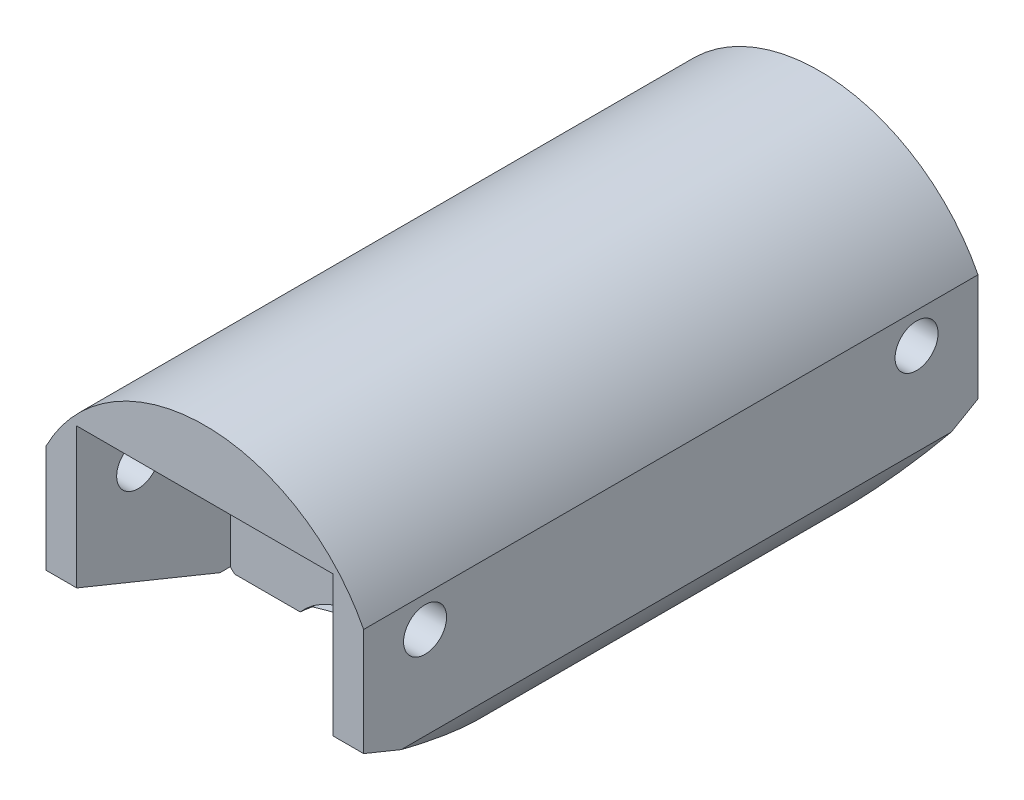
from build123d import *

# Parameters (mm, degrees)
BOSS_EXTRUDE1_DEPTH = 12.7
CUT_EXTRUDE1_DEPTH  = 21.412045122
CUT_EXTRUDE2_DEPTH  = 31.008691842
BOSS_EXTRUDE2_DEPTH = 13.1318
SKETCH7_W           = 2.54
SKETCH7_H           = 2.8575
CUT_EXTRUDE3_DEPTH  = 2.54
SKETCH9_W           = 2.54
SKETCH9_H           = 3.81
CUT_EXTRUDE5_DEPTH  = 20.522176282
SKETCH11_W          = 2.54
SKETCH11_H          = 3.81
CUT_EXTRUDE8_DEPTH  = 2.54
CUT_EXTRUDE9_DEPTH  = 1.27
CUT_EXTRUDE10_START = -2.54
SKETCH13_W          = 10.5918
SKETCH13_H          = 10.46363817
CUT_EXTRUDE10_DEPTH = 12.54
SKETCH10_R          = 0.889
CUT_EXTRUDE7_DEPTH  = 21.412045122
CUT_EXTRUDE11_DEPTH = 17.78
CUT_EXTRUDE12_DEPTH = 15.875
SKETCH16_W          = 0.284935898
SKETCH16_H          = 2.320192307
CUT_EXTRUDE13_DEPTH = 1


with BuildPart() as part:
    # Sketch1 → Boss-Extrude1 (new, symmetric)
    with BuildSketch(Plane.XY):
        with BuildLine():
            Line((0, 0), (0, 5.08))
            ThreePointArc((0, 5.08), (6.5659, 9.1059), (13.1318, 5.08))
            Line((13.1318, 5.08), (13.1318, 0))
            ThreePointArc((13.1318, 0), (6.5659, -4.0259), (0, 0))
        make_face()
    extrude(amount=BOSS_EXTRUDE1_DEPTH, both=True)

    # Sketch2 → Cut-Extrude1 (cut, through all)
    with BuildSketch(Plane(origin=(0, 0, 0), x_dir=(0, 0, -1), z_dir=(1, 0, 0))):
        Polygon((-12.7, -4.0259), (-12.7, 0.635), (-1.27, -4.0259), align=None)
        Polygon((12.7, 0.635), (12.7, -4.0259), (4.627084391, -4.0259), align=None)
        with BuildLine():
            Line((-10.16, 1.27), (-12.7, 1.27))
            Line((-12.7, 1.27), (-12.7, 3.81))
            Line((-12.7, 3.81), (-10.16, 3.81))
            ThreePointArc((-10.16, 3.81), (-5.420295474, 2.54), (-10.16, 1.27))
        make_face()
        with BuildLine():
            Line((10.16, 1.27), (12.7, 1.27))
            Line((12.7, 1.27), (12.7, 3.81))
            Line((12.7, 3.81), (10.16, 3.81))
            ThreePointArc((10.16, 3.81), (5.420295474, 2.54), (10.16, 1.27))
        make_face()
    extrude(amount=CUT_EXTRUDE1_DEPTH, mode=Mode.SUBTRACT)

    # Sketch3 → Cut-Extrude2 (cut, through all)
    with BuildSketch(Plane.XY.offset(12.7)):
        with BuildLine():
            ThreePointArc((3.929920413, -2.256087406), (6.5659, -2.7559), (9.201879587, -2.256087406))
            ThreePointArc((9.201879587, -2.256087406), (6.5659, -0.8509), (3.929920413, -2.256087406))
        make_face()
    extrude(amount=-CUT_EXTRUDE2_DEPTH, mode=Mode.SUBTRACT)

    # Sketch4 → Boss-Extrude2 (add)
    with BuildSketch(Plane.ZY):
        with BuildLine():
            Line((12.7, 1.27), (10.16, 1.27))
            ThreePointArc((10.16, 1.27), (9.230295474, 0.340295474), (7.960295474, 0))
            ThreePointArc((7.960295474, 0), (5.420295474, 2.54), (7.960295474, 5.08))
            ThreePointArc((7.960295474, 5.08), (9.230295474, 4.739704526), (10.16, 3.81))
            Line((10.16, 3.81), (12.7, 3.81))
            Line((12.7, 3.81), (12.7, 1.27))
        make_face()
        with BuildLine():
            Line((-10.16, 1.27), (-12.7, 1.27))
            Line((-12.7, 1.27), (-12.7, 3.81))
            Line((-12.7, 3.81), (-10.16, 3.81))
            ThreePointArc((-10.16, 3.81), (-9.230295474, 4.739704526), (-7.960295474, 5.08))
            ThreePointArc((-7.960295474, 5.08), (-5.420295474, 2.54), (-7.960295474, 0))
            ThreePointArc((-7.960295474, 0), (-9.230295474, 0.340295474), (-10.16, 1.27))
        make_face()
    extrude(amount=-BOSS_EXTRUDE2_DEPTH)

    # Sketch7 → Cut-Extrude3 (cut)
    with BuildSketch(Plane.ZY.offset(-5.08)):
        with Locations((-11.43, 1.42875)):
            Rectangle(SKETCH7_W, SKETCH7_H)
    extrude(amount=CUT_EXTRUDE3_DEPTH, mode=Mode.SUBTRACT)

    # Sketch9 → Cut-Extrude5 (cut, through all)
    with BuildSketch(Plane.XZ.offset(-2.8575)):
        with Locations((3.81, -10.795)):
            Rectangle(SKETCH9_W, SKETCH9_H)
    extrude(amount=CUT_EXTRUDE5_DEPTH, mode=Mode.SUBTRACT)

    # Sketch11 → Cut-Extrude8 (cut)
    with BuildSketch(Plane.XZ.offset(-2.8575)):
        with Locations((3.81, -10.795)):
            Rectangle(SKETCH11_W, SKETCH11_H)
    extrude(amount=-CUT_EXTRUDE8_DEPTH, mode=Mode.SUBTRACT)

    # Sketch12 → Cut-Extrude9 (cut)
    with BuildSketch(Plane(origin=(2.54, 0, 0), x_dir=(0, 0, -1), z_dir=(1, 0, 0))):
        Polygon((8.89, -1.564704526), (12.7, 0.635), (12.7, 5.3975), (8.89, 5.3975), align=None)
    extrude(amount=-CUT_EXTRUDE9_DEPTH, mode=Mode.SUBTRACT)

    # Sketch13 → Cut-Extrude10 (cut)
    with BuildSketch(Plane(origin=(0, 0, -8.89), x_dir=(-1, 0, 0), z_dir=(0, 0, -1)).offset(CUT_EXTRUDE10_START)):
        with Locations((-6.5659, 1.205919085)):
            Rectangle(SKETCH13_W, SKETCH13_H)
    cut_extrude10 = extrude(amount=CUT_EXTRUDE10_DEPTH, mode=Mode.SUBTRACT)

    # Sketch10 → Cut-Extrude7 (cut, through all)
    with BuildSketch(Plane.ZY):
        with Locations((-10.16, 3.81)):
            Circle(SKETCH10_R)
    cut_extrude7 = extrude(amount=-CUT_EXTRUDE7_DEPTH, mode=Mode.SUBTRACT)

    # Mirror1: Cut-Extrude10, Cut-Extrude7 across plane
    add(cut_extrude10.mirror(Plane(origin=(0, 0, 0), x_dir=(1, 0, 0), z_dir=(0, 0, -1))), mode=Mode.SUBTRACT)
    add(cut_extrude7.mirror(Plane(origin=(0, 0, 0), x_dir=(1, 0, 0), z_dir=(0, 0, -1))), mode=Mode.SUBTRACT)

    # Sketch14 → Cut-Extrude11 (cut)
    with BuildSketch(Plane.XY.offset(6.35)):
        with BuildLine():
            Line((8.5979, 5.338512594), (9.2329, 5.338512594))
            ThreePointArc((9.2329, 5.338512594), (9.6139, 4.957512594), (9.2329, 4.576512594))
            Line((9.2329, 4.576512594), (8.5979, 4.576512594))
            ThreePointArc((8.5979, 4.576512594), (8.2169, 4.957512594), (8.5979, 5.338512594))
        make_face()
    extrude(amount=-CUT_EXTRUDE11_DEPTH, mode=Mode.SUBTRACT)

    # Sketch15 → Cut-Extrude12 (cut)
    with BuildSketch(Plane(origin=(0, 0, -6.35), x_dir=(-1, 0, 0), z_dir=(0, 0, -1))):
        with BuildLine():
            Line((-4.9149, 5.477825791), (-4.2799, 5.477825791))
            ThreePointArc((-4.2799, 5.477825791), (-3.8989, 5.096825791), (-4.2799, 4.715825791))
            Line((-4.2799, 4.715825791), (-4.9149, 4.715825791))
            ThreePointArc((-4.9149, 4.715825791), (-5.2959, 5.096825791), (-4.9149, 5.477825791))
        make_face()
    extrude(amount=-CUT_EXTRUDE12_DEPTH, mode=Mode.SUBTRACT)

    # Sketch16 → Cut-Extrude13 (cut)
    # profile 1 of 7: a face of its own
    with BuildSketch(Plane.ZY):
        with BuildLine():
            Line((-6.896273002, 4.379184179), (-6.273611744, 4.379184179))
            add(Edge.make_bspline(
                [(-6.273611744, 4.379184179), (-6.230784708, 4.379137101), (-6.148726205, 4.379046899), (-6.031056118, 4.376312094), (-5.924185862, 4.372659309), (-5.828345873, 4.367595734), (-5.74324127, 4.361611685), (-5.669257148, 4.353218763), (-5.605811979, 4.344455495), (-5.567796843, 4.335546076), (-5.550459701, 4.331482857)],
                knots=[0, 0, 0, 0, 1.415646017, 2.712440637, 3.8905458, 4.950247383, 5.884950622, 6.709939814, 7.411656543, 8, 8, 8, 8], degree=3))
            add(Edge.make_bspline(
                [(-5.550459701, 4.331482857), (-5.52851271, 4.325475802), (-5.48513588, 4.313603242), (-5.422632791, 4.28982365), (-5.363166089, 4.261627686), (-5.306531746, 4.229493112), (-5.253425714, 4.192041207), (-5.203055662, 4.150790139), (-5.155866109, 4.104787502), (-5.112122418, 4.05454926), (-5.07194978, 4.000918784), (-5.03736071, 3.943095475), (-5.008398155, 3.88205265), (-4.983557615, 3.817832767), (-4.965679232, 3.749896545), (-4.952210973, 3.678716028), (-4.943662396, 3.604298844), (-4.942843644, 3.553444536), (-4.942426849, 3.527556574)],
                knots=[0, 0, 0, 0, 0.999701418, 1.975846123, 2.934577507, 3.890451536, 4.834027766, 5.787354733, 6.749476667, 7.726910423, 8.712836071, 9.690891519, 10.682875813, 11.679750201, 12.712814741, 13.765529915, 14.8625177, 16, 16, 16, 16], degree=3))
            add(Edge.make_bspline(
                [(-4.942426849, 3.527556574), (-4.942809141, 3.50145102), (-4.943557122, 3.450373739), (-4.952534466, 3.375649853), (-4.964626855, 3.304241027), (-4.983220609, 3.236305597), (-5.00757347, 3.172247005), (-5.036141261, 3.111086316), (-5.070597749, 3.053864043), (-5.110189844, 3.000372443), (-5.154233076, 2.950561308), (-5.202541099, 2.904791602), (-5.254918886, 2.863331238), (-5.311199977, 2.826087269), (-5.371933054, 2.793923358), (-5.436197008, 2.765114946), (-5.504550418, 2.740920484), (-5.551851128, 2.728193214), (-5.575900406, 2.72172224)],
                knots=[0, 0, 0, 0, 1.121902311, 2.195077645, 3.232258892, 4.234102512, 5.217864754, 6.176164875, 7.132989551, 8.084763148, 9.034132444, 9.988522005, 10.94243251, 11.903244335, 12.886203696, 13.894208494, 14.929344452, 16, 16, 16, 16], degree=3))
            add(Edge.make_bspline(
                [(-5.575900406, 2.72172224), (-5.595791631, 2.71749225), (-5.639384405, 2.708221981), (-5.711178161, 2.69787288), (-5.794767189, 2.689039486), (-5.8900374, 2.682416311), (-5.996903278, 2.676746334), (-6.115422633, 2.672239563), (-6.245828117, 2.669763195), (-6.33678846, 2.669635476), (-6.384278812, 2.669568794)],
                knots=[0, 0, 0, 0, 0.601384939, 1.31797006, 2.144135048, 3.087295005, 4.142315834, 5.309527816, 6.595305764, 8, 8, 8, 8], degree=3))
            Line((-6.384278812, 2.669568794), (-6.611337105, 2.669568794))
            Line((-6.611337105, 2.669568794), (-6.611337105, 1.204184179))
            Line((-6.611337105, 1.204184179), (-6.896273002, 1.204184179))
            Line((-6.896273002, 1.204184179), (-6.896273002, 4.379184179))
        make_face()
        with BuildLine():
            Line((-6.611337105, 4.053543153), (-6.611337105, 2.99520982))
            Line((-6.611337105, 2.99520982), (-6.055457698, 2.988213626))
            add(Edge.make_bspline(
                [(-6.055457698, 2.988213626), (-6.028316051, 2.988199598), (-5.975919661, 2.988172518), (-5.900231087, 2.991787685), (-5.830009805, 2.995961025), (-5.765471512, 3.00207147), (-5.706587114, 3.010708611), (-5.653258427, 3.01942783), (-5.605898963, 3.032041981), (-5.550473259, 3.049026479), (-5.488711936, 3.077993923), (-5.421522089, 3.120039895), (-5.3645802, 3.173634537), (-5.315305745, 3.23389407), (-5.276202556, 3.300931137), (-5.247576763, 3.372657959), (-5.230757284, 3.448338936), (-5.228501951, 3.500126034), (-5.227362746, 3.526284539)],
                knots=[0, 0, 0, 0, 1.160613943, 2.240541288, 3.23993089, 4.169200891, 5.011653406, 5.7853311, 6.478053781, 7.106038997, 8.262395093, 9.384106736, 10.481365981, 11.59014053, 12.70357646, 13.786202915, 14.881775077, 16, 16, 16, 16], degree=3))
            add(Edge.make_bspline(
                [(-5.227362746, 3.526284539), (-5.228508147, 3.551810191), (-5.230785062, 3.602552027), (-5.247708595, 3.676918474), (-5.276146901, 3.747889434), (-5.31556824, 3.814086447), (-5.363411979, 3.874129148), (-5.419019241, 3.926287256), (-5.482259128, 3.968216944), (-5.541085737, 3.995279992), (-5.593338242, 4.011803849), (-5.638724377, 4.02336524), (-5.689969489, 4.032595969), (-5.74709026, 4.040070375), (-5.809643959, 4.046468872), (-5.878168002, 4.050810437), (-5.952402807, 4.053351758), (-6.003938111, 4.05347781), (-6.03065301, 4.053543153)],
                knots=[0, 0, 0, 0, 1.120700087, 2.227813068, 3.331159281, 4.466773991, 5.599788987, 6.693661531, 7.80175334, 8.91857717, 9.525282508, 10.207424825, 10.974604443, 11.810962634, 12.737642355, 13.736264703, 14.826523623, 16, 16, 16, 16], degree=3))
            Line((-6.03065301, 4.053543153), (-6.611337105, 4.053543153))
        make_face(mode=Mode.SUBTRACT)
    # profile 2 of 7: a face of its own
    with BuildSketch(Plane.ZY):
        with BuildLine():
            add(Edge.make_bspline(
                [(-4.272064268, 4.501299563), (-4.25438286, 4.500479368), (-4.219759268, 4.498873268), (-4.169691089, 4.485119642), (-4.1241008, 4.461806356), (-4.083662428, 4.43052836), (-4.048962502, 4.393744222), (-4.024668572, 4.350871772), (-4.00905447, 4.304554293), (-4.007168923, 4.272246319), (-4.0062089, 4.255796759)],
                knots=[0, 0, 0, 0, 1.055194115, 2.066272739, 3.074728998, 4.095836921, 5.109056067, 6.073838105, 7.019297344, 8, 8, 8, 8], degree=3))
            add(Edge.make_bspline(
                [(-4.0062089, 4.255796759), (-4.007190573, 4.239774209), (-4.009131226, 4.208099525), (-4.024656512, 4.162585018), (-4.049169542, 4.120308275), (-4.083640177, 4.083595559), (-4.124106696, 4.052334854), (-4.169689523, 4.029016984), (-4.21975968, 4.015264573), (-4.254383, 4.013658306), (-4.272064268, 4.012838025)],
                knots=[0, 0, 0, 0, 0.96129708, 1.900370562, 2.859976407, 3.87933698, 4.906634145, 5.921202961, 6.938410037, 8, 8, 8, 8], degree=3))
            add(Edge.make_bspline(
                [(-4.272064268, 4.012838025), (-4.289543347, 4.013626985), (-4.323564089, 4.015162594), (-4.372882581, 4.029286824), (-4.41808414, 4.052342833), (-4.458601378, 4.083390873), (-4.492374482, 4.120533744), (-4.516956534, 4.162559217), (-4.532445964, 4.208106093), (-4.534391449, 4.239776416), (-4.535375566, 4.255796759)],
                knots=[0, 0, 0, 0, 1.054934014, 2.053291228, 3.073705704, 4.106921865, 5.123545215, 6.088680038, 7.033164197, 8, 8, 8, 8], degree=3))
            add(Edge.make_bspline(
                [(-4.535375566, 4.255796759), (-4.534413009, 4.272244029), (-4.532522486, 4.304547507), (-4.516944924, 4.350898001), (-4.492579241, 4.393516935), (-4.458579016, 4.430732924), (-4.418090091, 4.461798425), (-4.372881044, 4.484849816), (-4.323564495, 4.498975245), (-4.289543484, 4.500510688), (-4.272064268, 4.501299563)],
                knots=[0, 0, 0, 0, 0.98631895, 1.937192651, 2.907499808, 3.917963147, 4.944918757, 5.95915025, 6.951458133, 8, 8, 8, 8], degree=3))
        make_face()
    # profile 3 of 7: a face of its own
    with BuildSketch(Plane.ZY):
        with Locations((-4.270792233, 2.364280333)):
            Rectangle(SKETCH16_W, SKETCH16_H)
    # profile 4 of 7: a face of its own
    with BuildSketch(Plane.ZY):
        with BuildLine():
            Line((-3.436337105, 3.524376486), (-3.151401207, 3.524376486))
            Line((-3.151401207, 3.524376486), (-3.151401207, 3.105876887))
            add(Edge.make_bspline(
                [(-3.151401207, 3.105876887), (-3.120977781, 3.143834214), (-3.061940061, 3.217491732), (-2.963619988, 3.314302539), (-2.859712307, 3.394081421), (-2.750853346, 3.457675577), (-2.63689533, 3.505615017), (-2.518532899, 3.540236969), (-2.395057416, 3.560996777), (-2.311088248, 3.563709343), (-2.26860874, 3.565081615)],
                knots=[0, 0, 0, 0, 1.12780773, 2.188550248, 3.19190651, 4.159438251, 5.104880172, 6.052711206, 7.014878035, 8, 8, 8, 8], degree=3))
            add(Edge.make_bspline(
                [(-2.26860874, 3.565081615), (-2.225673093, 3.563498473), (-2.141637676, 3.560399883), (-2.019284006, 3.535891885), (-1.905008141, 3.494031546), (-1.799217544, 3.436689168), (-1.703852144, 3.365381867), (-1.620100314, 3.282307736), (-1.55082794, 3.186752861), (-1.504384618, 3.098103998), (-1.473790637, 3.019464877), (-1.454529874, 2.952112468), (-1.438173198, 2.877075288), (-1.423992969, 2.79458009), (-1.414398018, 2.704048874), (-1.406830368, 2.605852754), (-1.401406838, 2.500023535), (-1.401191657, 2.426829237), (-1.401080695, 2.38908502)],
                knots=[0, 0, 0, 0, 1.235846778, 2.418850247, 3.575807741, 4.728682307, 5.871620074, 6.994088408, 8.11269785, 9.256955736, 9.865816715, 10.540099792, 11.271859618, 12.076849838, 12.949306005, 13.892391288, 14.913166135, 16, 16, 16, 16], degree=3))
            Line((-1.401080695, 2.38908502), (-1.401080695, 1.204184179))
            Line((-1.401080695, 1.204184179), (-1.686016592, 1.204184179))
            Line((-1.686016592, 1.204184179), (-1.686016592, 2.295590429))
            add(Edge.make_bspline(
                [(-1.686016592, 2.295590429), (-1.686191859, 2.327179361), (-1.686527116, 2.387603612), (-1.687584524, 2.47411694), (-1.69013342, 2.552572622), (-1.693715104, 2.622783091), (-1.69895751, 2.684680929), (-1.704420897, 2.738392201), (-1.711101983, 2.783848714), (-1.717055483, 2.811212754), (-1.719725526, 2.82348506)],
                knots=[0, 0, 0, 0, 1.430800155, 2.736877192, 3.918605307, 4.986035426, 5.920637409, 6.731861385, 7.431261377, 8, 8, 8, 8], degree=3))
            add(Edge.make_bspline(
                [(-1.719725526, 2.82348506), (-1.729364401, 2.859508778), (-1.747916254, 2.928843289), (-1.793757795, 3.022890737), (-1.851646374, 3.102899094), (-1.922310851, 3.168373691), (-2.005068656, 3.219328664), (-2.099690135, 3.254683609), (-2.205262188, 3.276796367), (-2.279515806, 3.278998123), (-2.318218115, 3.280145717)],
                knots=[0, 0, 0, 0, 1.084156227, 2.086665306, 3.027808233, 3.945421172, 4.874247719, 5.839848303, 6.874090471, 8, 8, 8, 8], degree=3))
            add(Edge.make_bspline(
                [(-2.318218115, 3.280145717), (-2.341139513, 3.279713913), (-2.386500369, 3.278859383), (-2.453764986, 3.270285706), (-2.519010486, 3.256262678), (-2.582891676, 3.237331843), (-2.644130889, 3.21133107), (-2.704695639, 3.181822284), (-2.762305346, 3.145039263), (-2.818188428, 3.104044914), (-2.870179332, 3.058615919), (-2.918555753, 3.010678399), (-2.961679529, 2.959628387), (-3.00074897, 2.906288435), (-3.034474966, 2.849925982), (-3.063914553, 2.791084789), (-3.088893362, 2.729687411), (-3.101305519, 2.68707432), (-3.107515991, 2.665752688)],
                knots=[0, 0, 0, 0, 1.023777757, 2.026029729, 3.023749952, 4.003683103, 4.997618607, 5.993177895, 7.010360494, 8.046726602, 9.087585522, 10.09234134, 11.086953743, 12.070360549, 13.043493632, 14.017870808, 15.008233677, 16, 16, 16, 16], degree=3))
            add(Edge.make_bspline(
                [(-3.107515991, 2.665752688), (-3.111089815, 2.650099754), (-3.118869843, 2.616024135), (-3.127272871, 2.56010384), (-3.134899743, 2.495415506), (-3.141283269, 2.422034618), (-3.145188897, 2.33970426), (-3.149447386, 2.248776036), (-3.150997748, 2.148887371), (-3.151262955, 2.079344265), (-3.151401207, 2.04309143)],
                knots=[0, 0, 0, 0, 0.615963638, 1.340920617, 2.168419149, 3.115676021, 4.16674242, 5.331190069, 6.6087489, 8, 8, 8, 8], degree=3))
            Line((-3.151401207, 2.04309143), (-3.151401207, 1.204184179))
            Line((-3.151401207, 1.204184179), (-3.436337105, 1.204184179))
            Line((-3.436337105, 1.204184179), (-3.436337105, 3.524376486))
        make_face()
    # profile 5 of 7: a face of its own
    with BuildSketch(Plane.ZY):
        Polygon((-0.749798643, 4.460594435), (-0.464862746, 4.460594435), (-0.464862746, 2.577982256), (0.590926517, 3.524376486), (1.000521869, 3.524376486), (-0.224448082, 2.425338025), (1.122637254, 1.204184179), (0.713677919, 1.204184179), (-0.464862746, 2.273329812), (-0.464862746, 1.204184179), (-0.749798643, 1.204184179), align=None)
    # profile 6 of 7: a face of its own
    with BuildSketch(Plane.ZY):
        Polygon((1.20404751, 3.524376486), (1.511244025, 3.524376486), (2.296725796, 1.747343233), (3.094291901, 3.524376486), (3.402124434, 3.524376486), (1.977444946, 0.349376486), (1.669612414, 0.349376486), (2.142173512, 1.401985661), align=None)
    # profile 7 of 7: a face of its own
    with BuildSketch(Plane.ZY):
        with BuildLine():
            Line((5.193150075, 3.402261102), (4.908214177, 3.402261102))
            add(Edge.make_bspline(
                [(4.908214177, 3.402261102), (4.910071237, 3.44006255), (4.913718454, 3.514303588), (4.930798402, 3.622547418), (4.955237627, 3.726011414), (4.989792017, 3.823864835), (5.032705569, 3.916972896), (5.084167808, 4.004965768), (5.14512223, 4.087507775), (5.214252624, 4.163833725), (5.289335604, 4.233853879), (5.370348849, 4.294319706), (5.455479695, 4.34540788), (5.544469864, 4.388117292), (5.638323375, 4.420175581), (5.736188539, 4.443962354), (5.838495327, 4.458273753), (5.908200205, 4.459812073), (5.943650876, 4.460594435)],
                knots=[0, 0, 0, 0, 1.10065271, 2.161652631, 3.183658789, 4.190468796, 5.17591951, 6.163126047, 7.15150782, 8.156236427, 9.156009102, 10.134482811, 11.092018607, 12.041330605, 13.001268258, 13.972401359, 14.968799086, 16, 16, 16, 16], degree=3))
            add(Edge.make_bspline(
                [(5.943650876, 4.460594435), (5.978465272, 4.459779407), (6.046874316, 4.458177905), (6.146716286, 4.444424686), (6.24176426, 4.422884042), (6.331832448, 4.3926622), (6.416202236, 4.352036327), (6.495507426, 4.303234274), (6.570692161, 4.246791998), (6.638371172, 4.180340324), (6.700517787, 4.10939959), (6.754131976, 4.033664134), (6.800045345, 3.955441854), (6.838315598, 3.874136271), (6.866487952, 3.788981838), (6.887876755, 3.701218304), (6.899966624, 3.609937226), (6.901822115, 3.54815485), (6.902765459, 3.516744275)],
                knots=[0, 0, 0, 0, 1.111607364, 2.184268762, 3.212621178, 4.221274766, 5.211760367, 6.196651075, 7.1921475, 8.207485113, 9.220403448, 10.201281604, 11.166441695, 12.114753415, 13.065576456, 14.026450734, 14.996634279, 16, 16, 16, 16], degree=3))
            add(Edge.make_bspline(
                [(6.902765459, 3.516744275), (6.901229428, 3.472523025), (6.89818432, 3.384856545), (6.872136279, 3.256028777), (6.831454087, 3.13121189), (6.78247077, 3.030757337), (6.733056482, 2.949809811), (6.6885271, 2.8831632), (6.636398307, 2.811403239), (6.575911384, 2.734770226), (6.508317564, 2.652663905), (6.433004601, 2.565133876), (6.349435443, 2.473084485), (6.290780946, 2.410214404), (6.260387655, 2.377636703)],
                knots=[0, 0, 0, 0, 1.184426356, 2.348067706, 3.509069118, 4.696110526, 5.333549288, 6.050745305, 6.844228056, 7.710549037, 8.667450064, 9.695053472, 10.805634456, 12, 12, 12, 12], degree=3))
            Line((6.260387655, 2.377636703), (5.466001637, 1.529825204))
            Line((5.466001637, 1.529825204), (6.943470587, 1.529825204))
            Line((6.943470587, 1.529825204), (6.943470587, 1.204184179))
            Line((6.943470587, 1.204184179), (4.786098793, 1.204184179))
            Line((4.786098793, 1.204184179), (6.017428921, 2.518196599))
            add(Edge.make_bspline(
                [(6.017428921, 2.518196599), (6.047408075, 2.549491491), (6.104991895, 2.609602574), (6.186437519, 2.69736226), (6.259588601, 2.778777915), (6.324918664, 2.853695712), (6.381010487, 2.923211491), (6.43078744, 2.98507383), (6.470670512, 3.042001081), (6.513955193, 3.107987209), (6.555877876, 3.188552669), (6.591902656, 3.287008229), (6.613868983, 3.388360809), (6.616504083, 3.456851942), (6.617829562, 3.49130357)],
                knots=[0, 0, 0, 0, 1.329631726, 2.553950428, 3.673215718, 4.687767853, 5.603093632, 6.413772471, 7.123043292, 7.734684054, 8.834405432, 9.900288307, 10.943827018, 12, 12, 12, 12], degree=3))
            add(Edge.make_bspline(
                [(6.617829562, 3.49130357), (6.617252853, 3.51296741), (6.61611627, 3.555662678), (6.606085358, 3.61826076), (6.590926542, 3.678644555), (6.569204772, 3.736999802), (6.540532944, 3.792739787), (6.505632092, 3.845932358), (6.465363963, 3.897357348), (6.418781026, 3.945574983), (6.367607719, 3.98973579), (6.313547221, 4.028855496), (6.256351769, 4.061548118), (6.196262516, 4.088348291), (6.133446983, 4.109371672), (6.067783678, 4.123939098), (5.999454035, 4.133085351), (5.952796506, 4.13432285), (5.92902247, 4.134953409)],
                knots=[0, 0, 0, 0, 0.991446411, 1.95395049, 2.89581595, 3.838931463, 4.798493298, 5.75982156, 6.748411868, 7.785213223, 8.824556874, 9.840280684, 10.836137867, 11.835679398, 12.848801643, 13.863922112, 14.911575587, 16, 16, 16, 16], degree=3))
            add(Edge.make_bspline(
                [(5.92902247, 4.134953409), (5.904193215, 4.134304773), (5.855432657, 4.133030958), (5.78384182, 4.124120399), (5.715546865, 4.108748101), (5.650375996, 4.087723546), (5.588218943, 4.061000434), (5.529377988, 4.02771578), (5.473985225, 3.987997897), (5.421936521, 3.942966821), (5.37398134, 3.892831211), (5.331847389, 3.836942173), (5.29503189, 3.77632016), (5.262910657, 3.711128747), (5.236825138, 3.640776389), (5.216892352, 3.565512828), (5.201119998, 3.485664861), (5.19585084, 3.430524105), (5.193150075, 3.402261102)],
                knots=[0, 0, 0, 0, 1.031018746, 2.02475058, 2.990194455, 3.934040569, 4.864654155, 5.795059489, 6.735614925, 7.690564532, 8.649604399, 9.611025574, 10.590972636, 11.591080095, 12.624614302, 13.701020113, 14.821632451, 16, 16, 16, 16], degree=3))
        make_face()
    extrude(amount=-CUT_EXTRUDE13_DEPTH, mode=Mode.SUBTRACT)


solid = part.part
